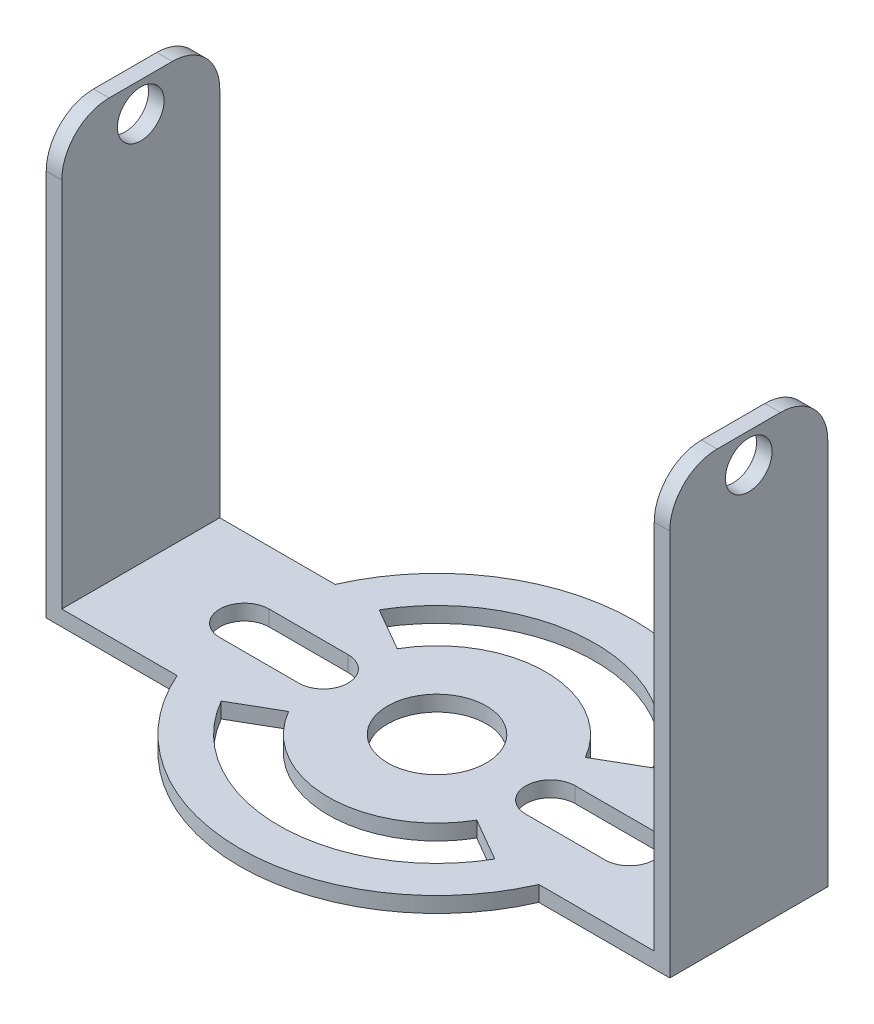
from build123d import *

# Parameters (mm, degrees)
SKETCH1_R           = 3.175
BOSS_EXTRUDE1_DEPTH = 1
BOSS_EXTRUDE2_DEPTH = 1
BOSS_EXTRUDE3_START = 1
BOSS_EXTRUDE3_DEPTH = 1
SKETCH4_R           = 1.5
CUT_EXTRUDE1_DEPTH  = 51.4944901


with BuildPart() as part:
    # Sketch1 → Boss-Extrude1 (new body)
    with BuildSketch(Plane(origin=(0, 0, 0), x_dir=(1, 0, 0), z_dir=(0, 1, 0))):
        with BuildLine():
            Line((11.628995247, 5.08), (19.05, 5.08))
            Line((19.05, 5.08), (19.05, -5.08))
            Line((19.05, -5.08), (11.628995247, -5.08))
            ThreePointArc((11.628995247, -5.08), (0, -12.690150923), (-11.628995247, -5.08))
            Line((-11.628995247, -5.08), (-19.05, -5.08))
            Line((-19.05, -5.08), (-19.05, 5.08))
            Line((-19.05, 5.08), (-11.628995247, 5.08))
            ThreePointArc((-11.628995247, 5.08), (0, 12.690150923), (11.628995247, 5.08))
        make_face()
        with Locations(Location((0, 0, 0), (0, 0, 270))):
            Circle(SKETCH1_R, mode=Mode.SUBTRACT)
        with BuildLine():
            Line((8.798818102, 5.08), (6.049187445, 3.4925))
            ThreePointArc((6.049187445, 3.4925), (0, 6.983078605), (-6.049187445, 3.4925))
            Line((-6.049187445, 3.4925), (-8.798818102, 5.08))
            ThreePointArc((-8.798818102, 5.08), (0, 10.158078357), (8.798818102, 5.08))
        make_face(mode=Mode.SUBTRACT)
        with BuildLine():
            Line((8.798818102, -5.08), (6.049187445, -3.4925))
            ThreePointArc((6.049187445, -3.4925), (0, -6.986922982), (-6.049187445, -3.4925))
            Line((-6.049187445, -3.4925), (-8.798818102, -5.08))
            ThreePointArc((-8.798818102, -5.08), (0, -10.161922734), (8.798818102, -5.08))
        make_face(mode=Mode.SUBTRACT)
        with BuildLine():
            Line((12.3825, -1.5875), (7.3025, -1.5875))
            ThreePointArc((7.3025, -1.5875), (5.715, 0), (7.3025, 1.5875))
            Line((7.3025, 1.5875), (12.3825, 1.5875))
            ThreePointArc((12.3825, 1.5875), (13.97, 0), (12.3825, -1.5875))
        make_face(mode=Mode.SUBTRACT)
        with BuildLine():
            Line((-7.3025, 1.5875), (-12.3825, 1.5875))
            ThreePointArc((-12.3825, 1.5875), (-13.97, 0), (-12.3825, -1.5875))
            Line((-12.3825, -1.5875), (-7.3025, -1.5875))
            ThreePointArc((-7.3025, -1.5875), (-5.715, 0), (-7.3025, 1.5875))
        make_face(mode=Mode.SUBTRACT)
    extrude(amount=BOSS_EXTRUDE1_DEPTH)

    # Sketch2 → Boss-Extrude2 (add)
    with BuildSketch(Plane(origin=(19.05, 0, -13.97), x_dir=(0, 0, -1), z_dir=(1, 0, 0))):
        with BuildLine():
            Line((-19.05, 0), (-8.89, 0))
            Line((-8.89, 0), (-8.89, 24.892))
            ThreePointArc((-8.89, 24.892), (-9.782738531, 27.047261469), (-11.938, 27.94))
            Line((-11.938, 27.94), (-16.002, 27.94))
            ThreePointArc((-16.002, 27.94), (-18.157261469, 27.047261469), (-19.05, 24.892))
            Line((-19.05, 24.892), (-19.05, 0))
        make_face()
    extrude(amount=BOSS_EXTRUDE2_DEPTH)

    # Sketch3 → Boss-Extrude3 (add)
    with BuildSketch(Plane(origin=(-19.05, 0, 13.97), x_dir=(0, 0, 1), z_dir=(-1, 0, 0)).offset(BOSS_EXTRUDE3_START)):
        with BuildLine():
            Line((-8.89, 0), (-19.05, 0))
            Line((-19.05, 0), (-19.05, 24.892))
            ThreePointArc((-19.05, 24.892), (-18.157261469, 27.047261469), (-16.002, 27.94))
            Line((-16.002, 27.94), (-11.938, 27.94))
            ThreePointArc((-11.938, 27.94), (-9.782738531, 27.047261469), (-8.89, 24.892))
            Line((-8.89, 24.892), (-8.89, 0))
        make_face()
    extrude(amount=-BOSS_EXTRUDE3_DEPTH)

    # Sketch4 → Cut-Extrude1 (cut, through all)
    with BuildSketch(Plane.ZY.offset(20.05)):
        with Locations((0, 26.035)):
            Circle(SKETCH4_R)
    extrude(amount=-CUT_EXTRUDE1_DEPTH, mode=Mode.SUBTRACT)


solid = part.part
